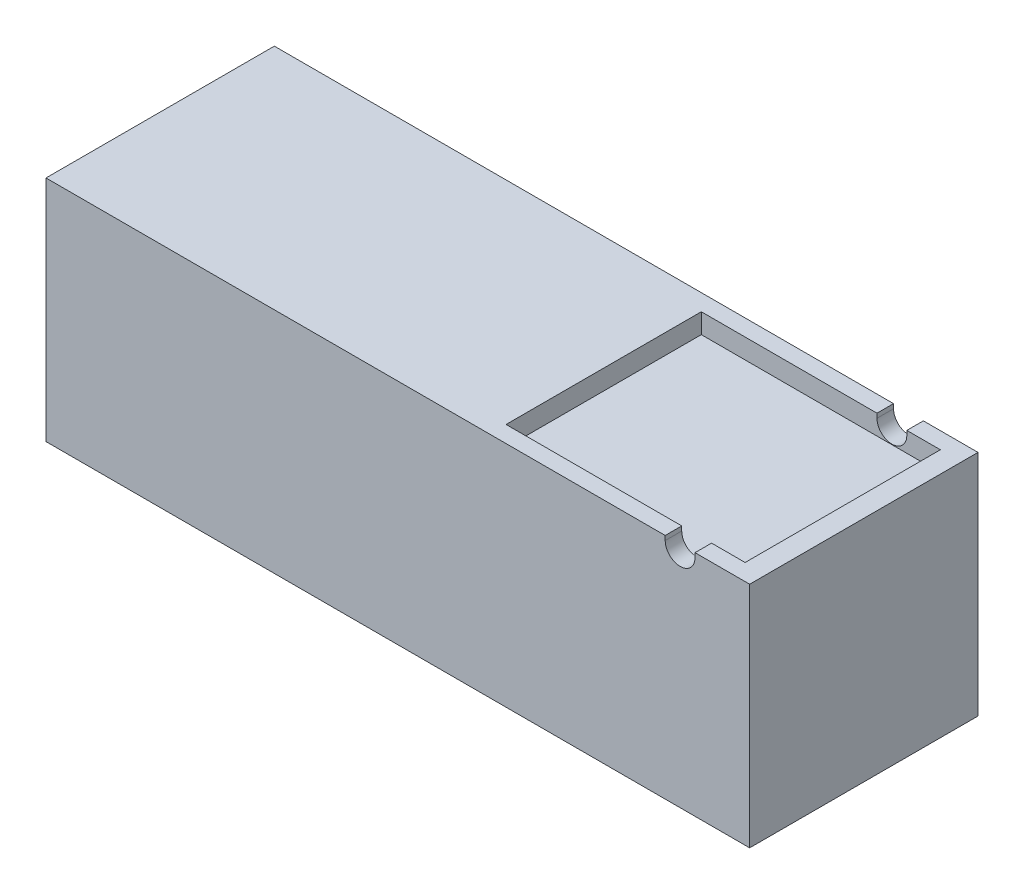
from build123d import *

# Parameters (mm, degrees)
SKETCH1_W               = 151
SKETCH1_H               = 49
BOSS_EXTRUDE1_DEPTH     = 49
SKETCH2_W               = 51.3
SKETCH2_H               = 41.9
CUT_EXTRUDE1_DEPTH      = 4.2596
CUT_EXTRUDE2_DEPTH      = 103.480485947
CUT_EXTRUDE2_DEPTH_BACK = 103.480485947


with BuildPart() as part:
    # Sketch1 → Boss-Extrude1 (new body)
    with BuildSketch(Plane(origin=(0, 0, 0), x_dir=(1, 0, 0), z_dir=(0, 1, 0))):
        Rectangle(SKETCH1_W, SKETCH1_H)
    extrude(amount=BOSS_EXTRUDE1_DEPTH)

    # Sketch2 → Cut-Extrude1 (cut)
    with BuildSketch(Plane(origin=(0, 49, 0), x_dir=(1, 0, 0), z_dir=(0, 1, 0))):
        with Locations((45.324412799, 0)):
            Rectangle(SKETCH2_W, SKETCH2_H)
    extrude(amount=-CUT_EXTRUDE1_DEPTH, mode=Mode.SUBTRACT)

    # Sketch6 → Cut-Extrude2 (cut, two sides: drawn at the far end of the back side and taken through both)
    with BuildSketch(Plane(origin=(0, 0, -24.5), x_dir=(-1, 0, 0), z_dir=(0, 0, -1)).offset(-CUT_EXTRUDE2_DEPTH_BACK)):
        with BuildLine():
            Line((-63.774014365, 48.05), (-63.774014365, 49))
            ThreePointArc((-63.774014365, 49), (-60.574014365, 52.2), (-57.374014365, 49))
            Line((-57.374014365, 49), (-57.374014365, 48.05))
            ThreePointArc((-57.374014365, 48.05), (-60.574014365, 44.85), (-63.774014365, 48.05))
        make_face()
    extrude(amount=CUT_EXTRUDE2_DEPTH + CUT_EXTRUDE2_DEPTH_BACK, mode=Mode.SUBTRACT)


solid = part.part
